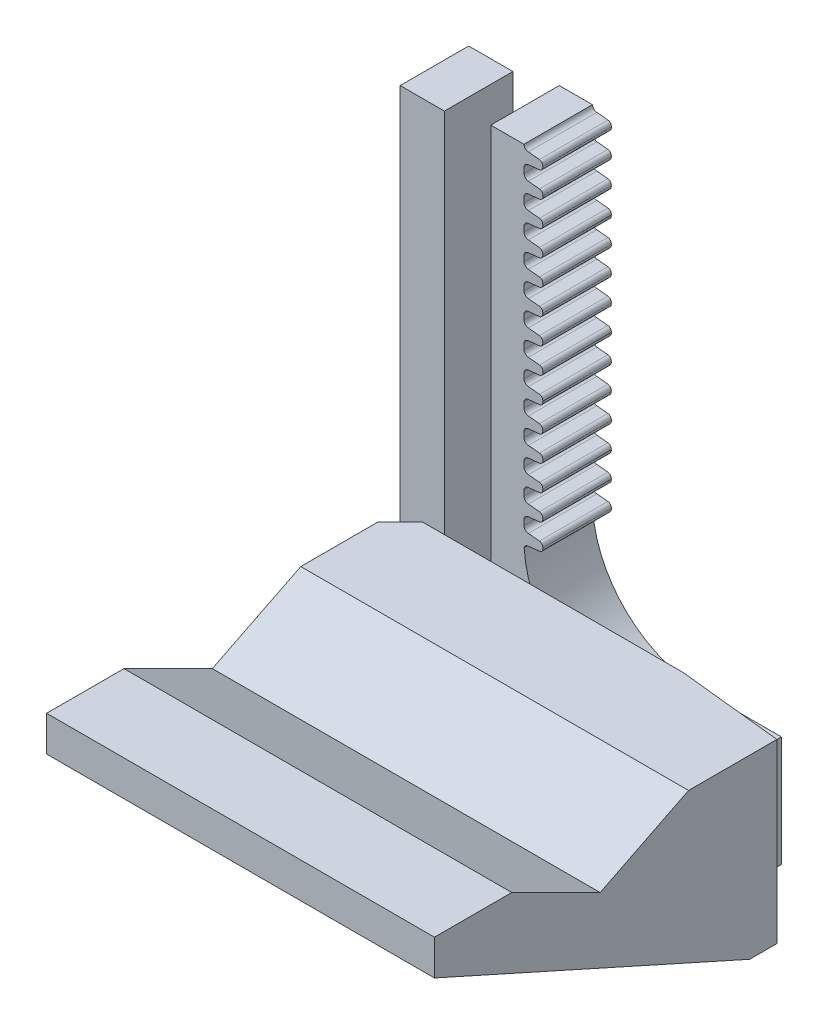
from build123d import *

# Parameters (mm, degrees)
BOSS_EXTRUDE1_DEPTH = 6.2
BOSS_EXTRUDE2_DEPTH = 21
CHAMFER1_SIZE       = 5
CHAMFER1_SIZE2      = 28.356409098
CUT_EXTRUDE1_REACH  = 74.109
CHAMFER2_SIZE       = 1
CHAMFER2_SIZE2      = 9.514364454
CHAMFER3_SIZE       = 2
CUT_EXTRUDE2_REACH  = 79.092
CUT_EXTRUDE3_START  = -3.468867
CUT_EXTRUDE3_DEPTH  = 3.468867
BOSS_EXTRUDE3_DEPTH = 6.2
CUT_EXTRUDE4_REACH  = 79.092


with BuildPart() as part:
    # Sketch1 → Boss-Extrude1 (new body)
    with BuildSketch(Plane.XY):
        with BuildLine():
            Line((-28.3, 0), (0, 0))
            Line((0, 0), (0, 10))
            Line((0, 10), (-7.1, 10))
            ThreePointArc((-7.1, 10), (-14.171067812, 12.928932188), (-17.1, 20))
            Line((-17.1, 20), (-17.1, 51))
            Line((-17.1, 51), (-20.1, 51))
            Line((-20.1, 51), (-20.1, 6))
            Line((-20.1, 6), (-24.3, 6))
            Line((-24.3, 6), (-24.3, 50))
            Line((-24.3, 50), (-28.3, 50))
            Line((-28.3, 50), (-28.3, 0))
        make_face()
    extrude(amount=BOSS_EXTRUDE1_DEPTH)

    # Sketch2 → Boss-Extrude2 (add)
    with BuildSketch(Plane.XZ):
        Polygon((0, 6.2), (0, 10.4), (11, 10.4), (11, 42.4), (-24.1, 42.4), (-24.1, 10.4), (-13.1, 10.4), (-13.1, 6.2), align=None)
    extrude(amount=-BOSS_EXTRUDE2_DEPTH)

    # Chamfer1
    chamfer1_edges = [part.edges().sort_by_distance(p)[0] for p in [
        (-6.55, 0, 42.4),
    ]]
    chamfer1_side = [part.faces().sort_by_distance(p)[0] for p in [
        (-6.55, 10.5, 42.4),
    ]]
    chamfer(chamfer1_edges, length=CHAMFER1_SIZE, length2=CHAMFER1_SIZE2, reference=chamfer1_side[0])

    # Sketch3 → Cut-Extrude1 (cut, up to next)
    with BuildSketch(Plane(origin=(0, 0, 0), x_dir=(0, 0, -1), z_dir=(1, 0, 0)), mode=Mode.PRIVATE) as cut_extrude1_sk1:
        Polygon((-6.2, 10), (-7.6, 10), (-10.4, 21), (-6.2, 21), align=None)
    cut_extrude1_tool1 = extrude(cut_extrude1_sk1.sketch, amount=-CUT_EXTRUDE1_REACH, mode=Mode.PRIVATE) & part.part
    add(cut_extrude1_tool1.solids().sort_by_distance((0, 16.416667, 7.716667))[0], mode=Mode.SUBTRACT)

    # Chamfer2
    chamfer2_edges = [part.edges().sort_by_distance(p)[0] for p in [
        (11, 10.5, 10.4),
    ]]
    chamfer2_side = [part.faces().sort_by_distance(p)[0] for p in [
        (11, 11.541747932, 25.62778603),
    ]]
    chamfer(chamfer2_edges, length=CHAMFER2_SIZE, length2=CHAMFER2_SIZE2, reference=chamfer2_side[0])

    # Chamfer3
    chamfer3_edges = [part.edges().sort_by_distance(p)[0] for p in [
        (-24.1, 10.5, 10.4),
    ]]
    chamfer(chamfer3_edges, length=CHAMFER3_SIZE)

    # Sketch5 → Cut-Extrude2 (cut, up to next)
    with BuildSketch(Plane(origin=(11, 0, 0), x_dir=(0, 0, -1), z_dir=(1, 0, 0)), mode=Mode.PRIVATE) as cut_extrude2_sk1:
        Polygon((-42.4, 17.8), (-13.86886709, 5), (-10.966215349, -4.108657177), (-44.036924755, 0.937700744), align=None)
    cut_extrude2_tool1 = extrude(cut_extrude2_sk1.sketch, amount=-CUT_EXTRUDE2_REACH, mode=Mode.PRIVATE) & part.part
    add(cut_extrude2_tool1.solids().sort_by_distance((11, 5.258773, 29.627692))[0], mode=Mode.SUBTRACT)

    # Sketch6 → Cut-Extrude3 (cut)
    with BuildSketch(Plane(origin=(0, 0, 10.4), x_dir=(-1, 0, 0), z_dir=(0, 0, -1)).offset(CUT_EXTRUDE3_START)):
        Polygon((13.1, 0), (24.1, 5), (37.198342989, 5), (28.62602328, -4.522208447), (-13.825974113, -5.629287686), (-20.705007466, 5), (-11, 5), (0, 0), align=None)
    extrude(amount=CUT_EXTRUDE3_DEPTH, mode=Mode.SUBTRACT)

    # Sketch7 → Boss-Extrude3 (add)
    with BuildSketch(Plane.XY.offset(6.2)):
        with BuildLine():
            Line((-16.7, 50.6), (-15.7, 50.5))
            ThreePointArc((-15.7, 50.5), (-15.462165524, 50.365875857), (-15.4, 50.1))
            ThreePointArc((-15.4, 50.1), (-15.462165524, 49.834124143), (-15.7, 49.7))
            Line((-15.7, 49.7), (-16.7, 49.6))
            ThreePointArc((-16.7, 49.6), (-16.971392676, 49.471392676), (-17.1, 49.2))
            Line((-17.1, 49.2), (-17.1, 48.7))
            ThreePointArc((-17.1, 48.7), (-16.971392676, 48.428607324), (-16.7, 48.3))
            Line((-16.7, 48.3), (-15.7, 48.2))
            ThreePointArc((-15.7, 48.2), (-15.462165524, 48.065875857), (-15.4, 47.8))
            ThreePointArc((-15.4, 47.8), (-15.462165524, 47.534124143), (-15.7, 47.4))
            Line((-15.7, 47.4), (-16.7, 47.3))
            ThreePointArc((-16.7, 47.3), (-16.971392676, 47.171392676), (-17.1, 46.9))
            Line((-17.1, 46.9), (-17.1, 46.4))
            ThreePointArc((-17.1, 46.4), (-16.971392676, 46.128607324), (-16.7, 46))
            Line((-16.7, 46), (-15.7, 45.9))
            ThreePointArc((-15.7, 45.9), (-15.462165524, 45.765875857), (-15.4, 45.5))
            ThreePointArc((-15.4, 45.5), (-15.462165524, 45.234124143), (-15.7, 45.1))
            Line((-15.7, 45.1), (-16.7, 45))
            ThreePointArc((-16.7, 45), (-16.971392676, 44.871392676), (-17.1, 44.6))
            Line((-17.1, 44.6), (-17.1, 44.1))
            ThreePointArc((-17.1, 44.1), (-16.971392676, 43.828607324), (-16.7, 43.7))
            Line((-16.7, 43.7), (-15.7, 43.6))
            ThreePointArc((-15.7, 43.6), (-15.462165524, 43.465875857), (-15.4, 43.2))
            ThreePointArc((-15.4, 43.2), (-15.462165524, 42.934124143), (-15.7, 42.8))
            Line((-15.7, 42.8), (-16.7, 42.7))
            ThreePointArc((-16.7, 42.7), (-16.971392676, 42.571392676), (-17.1, 42.3))
            Line((-17.1, 42.3), (-17.1, 41.8))
            ThreePointArc((-17.1, 41.8), (-16.971392676, 41.528607324), (-16.7, 41.4))
            Line((-16.7, 41.4), (-15.7, 41.3))
            ThreePointArc((-15.7, 41.3), (-15.462165524, 41.165875857), (-15.4, 40.9))
            ThreePointArc((-15.4, 40.9), (-15.462165524, 40.634124143), (-15.7, 40.5))
            Line((-15.7, 40.5), (-16.7, 40.4))
            ThreePointArc((-16.7, 40.4), (-16.971392676, 40.271392676), (-17.1, 40))
            Line((-17.1, 40), (-17.1, 39.5))
            ThreePointArc((-17.1, 39.5), (-16.971392676, 39.228607324), (-16.7, 39.1))
            Line((-16.7, 39.1), (-15.7, 39))
            ThreePointArc((-15.7, 39), (-15.462165524, 38.865875857), (-15.4, 38.6))
            ThreePointArc((-15.4, 38.6), (-15.462165524, 38.334124143), (-15.7, 38.2))
            Line((-15.7, 38.2), (-16.7, 38.1))
            ThreePointArc((-16.7, 38.1), (-16.971392676, 37.971392676), (-17.1, 37.7))
            Line((-17.1, 37.7), (-17.1, 37.2))
            ThreePointArc((-17.1, 37.2), (-16.971392676, 36.928607324), (-16.7, 36.8))
            Line((-16.7, 36.8), (-15.7, 36.7))
            ThreePointArc((-15.7, 36.7), (-15.462165524, 36.565875857), (-15.4, 36.3))
            ThreePointArc((-15.4, 36.3), (-15.462165524, 36.034124143), (-15.7, 35.9))
            Line((-15.7, 35.9), (-16.7, 35.8))
            ThreePointArc((-16.7, 35.8), (-16.971392676, 35.671392676), (-17.1, 35.4))
            Line((-17.1, 35.4), (-17.1, 34.9))
            ThreePointArc((-17.1, 34.9), (-16.971392676, 34.628607324), (-16.7, 34.5))
            Line((-16.7, 34.5), (-15.7, 34.4))
            ThreePointArc((-15.7, 34.4), (-15.462165524, 34.265875857), (-15.4, 34))
            ThreePointArc((-15.4, 34), (-15.462165524, 33.734124143), (-15.7, 33.6))
            Line((-15.7, 33.6), (-16.7, 33.5))
            ThreePointArc((-16.7, 33.5), (-16.971392676, 33.371392676), (-17.1, 33.1))
            Line((-17.1, 33.1), (-17.1, 32.6))
            ThreePointArc((-17.1, 32.6), (-16.971392676, 32.328607324), (-16.7, 32.2))
            Line((-16.7, 32.2), (-15.7, 32.1))
            ThreePointArc((-15.7, 32.1), (-15.462165524, 31.965875857), (-15.4, 31.7))
            ThreePointArc((-15.4, 31.7), (-15.462165524, 31.434124143), (-15.7, 31.3))
            Line((-15.7, 31.3), (-16.7, 31.2))
            ThreePointArc((-16.7, 31.2), (-16.971392676, 31.071392676), (-17.1, 30.8))
            Line((-17.1, 30.8), (-17.1, 30.3))
            ThreePointArc((-17.1, 30.3), (-16.971392676, 30.028607324), (-16.7, 29.9))
            Line((-16.7, 29.9), (-15.7, 29.8))
            ThreePointArc((-15.7, 29.8), (-15.462165524, 29.665875857), (-15.4, 29.4))
            ThreePointArc((-15.4, 29.4), (-15.462165524, 29.134124143), (-15.7, 29))
            Line((-15.7, 29), (-16.7, 28.9))
            ThreePointArc((-16.7, 28.9), (-16.971392676, 28.771392676), (-17.1, 28.5))
            Line((-17.1, 28.5), (-17.1, 28))
            ThreePointArc((-17.1, 28), (-16.971392676, 27.728607324), (-16.7, 27.6))
            Line((-16.7, 27.6), (-15.7, 27.5))
            ThreePointArc((-15.7, 27.5), (-15.462165524, 27.365875857), (-15.4, 27.1))
            ThreePointArc((-15.4, 27.1), (-15.462165524, 26.834124143), (-15.7, 26.7))
            Line((-15.7, 26.7), (-16.7, 26.6))
            ThreePointArc((-16.7, 26.6), (-16.971392676, 26.471392676), (-17.1, 26.2))
            Line((-17.1, 26.2), (-17.1, 25.7))
            ThreePointArc((-17.1, 25.7), (-16.971392676, 25.428607324), (-16.7, 25.3))
            Line((-16.7, 25.3), (-15.7, 25.2))
            ThreePointArc((-15.7, 25.2), (-15.462165524, 25.065875857), (-15.4, 24.8))
            ThreePointArc((-15.4, 24.8), (-15.462165524, 24.534124143), (-15.7, 24.4))
            Line((-15.7, 24.4), (-16.7, 24.3))
            ThreePointArc((-16.7, 24.3), (-16.971392676, 24.171392676), (-17.1, 23.9))
            Line((-17.1, 23.9), (-17.1, 23.4))
            ThreePointArc((-17.1, 23.4), (-16.971392676, 23.128607324), (-16.7, 23))
            Line((-16.7, 23), (-15.7, 22.9))
            ThreePointArc((-15.7, 22.9), (-15.462165524, 22.765875857), (-15.4, 22.5))
            ThreePointArc((-15.4, 22.5), (-15.462165524, 22.234124143), (-15.7, 22.1))
            Line((-15.7, 22.1), (-16.7, 22))
            ThreePointArc((-16.7, 22), (-16.971392676, 21.871392676), (-17.1, 21.6))
            Line((-17.1, 21.6), (-17.1, 21.1))
            ThreePointArc((-17.1, 21.1), (-16.971392676, 20.828607324), (-16.7, 20.7))
            Line((-16.7, 20.7), (-15.7, 20.6))
            ThreePointArc((-15.7, 20.6), (-15.462165524, 20.465875857), (-15.4, 20.2))
            ThreePointArc((-15.4, 20.2), (-15.462165524, 19.934124143), (-15.7, 19.8))
            Line((-15.7, 19.8), (-16.7, 19.7))
            ThreePointArc((-16.7, 19.7), (-16.971392676, 19.571392676), (-17.1, 19.3))
            Line((-17.1, 19.3), (-17.1, 18.8))
            Line((-17.1, 18.8), (-18.685, 49.2))
            Line((-18.685, 49.2), (-17.1, 51))
            ThreePointArc((-17.1, 51), (-16.971392676, 50.728607324), (-16.7, 50.6))
        make_face()
    extrude(amount=-BOSS_EXTRUDE3_DEPTH)

    # Sketch8 → Cut-Extrude4 (cut, up to next)
    with BuildSketch(Plane(origin=(11, 0, 0), x_dir=(0, 0, -1), z_dir=(1, 0, 0)), mode=Mode.PRIVATE) as cut_extrude4_sk1:
        Polygon((-35.4, 21), (-27.4, 17), (-19.4, 21), align=None)
    cut_extrude4_tool1 = extrude(cut_extrude4_sk1.sketch, amount=-CUT_EXTRUDE4_REACH, mode=Mode.PRIVATE) & part.part
    add(cut_extrude4_tool1.solids().sort_by_distance((11, 19.666667, 27.4))[0], mode=Mode.SUBTRACT)


solid = part.part
